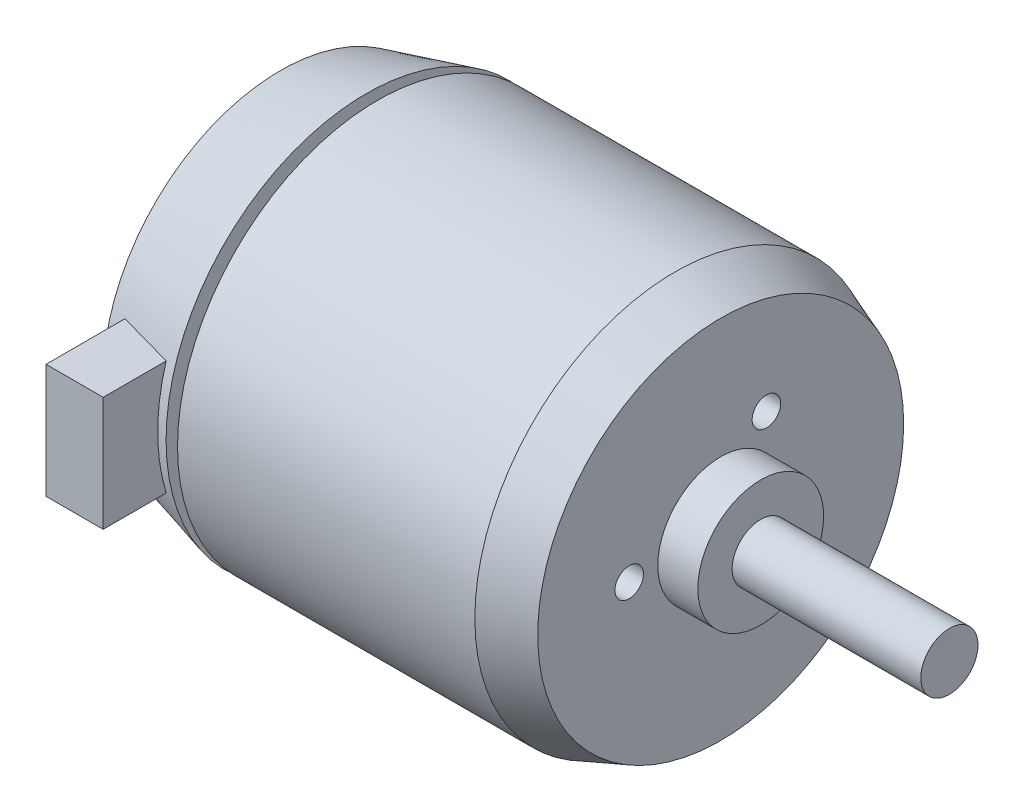
from build123d import *

# Parameters (mm, degrees)
BOSS_EXTRUDE1_REACH            = 59.868
SKETCH2_W                      = 5
SKETCH2_H                      = 10
SKETCH3_R                      = 4
BOSS_EXTRUDE2_DEPTH            = 1
SKETCH4_R                      = 5.5
BOSS_EXTRUDE3_DEPTH            = 3.5
SKETCH5_R                      = 2.5
BOSS_EXTRUDE4_DEPTH            = 16.5
F_2_5_2_5_DIAMETER_HOLE1_D     = 2.5
F_2_5_2_5_DIAMETER_HOLE1_DEPTH = 28
F_2_5_2_5_DIAMETER_HOLE1_TIP   = 0.751075774
F_3_0_3_DIAMETER_HOLE1_D       = 3
F_3_0_3_DIAMETER_HOLE1_DEPTH   = 28
F_3_0_3_DIAMETER_HOLE1_TIP     = 0.901290929
CHAMFER1_SIZE                  = 1.5
CHAMFER1_SIZE2                 = 4


with BuildPart() as part:
    # Sketch1 → Revolve1 (revolve)
    with BuildSketch(Plane.XY, mode=Mode.PRIVATE) as revolve1_sk:
        Polygon((0, 15.5), (0, 0), (38.5, 0), (38.5, 17.5), (8.5, 17.5), (8.5, 12.5), (7.5, 12.5), (7.5, 17.5), align=None)
    revolve(revolve1_sk.sketch.rotate(Axis((0, 0, 0), (1, 0, 0)), 270), axis=Axis((0, 0, 0), (1, 0, 0)))

    # Sketch2 → Boss-Extrude1 (add, up to next)
    with BuildSketch(Plane.XY.offset(22), mode=Mode.PRIVATE) as boss_extrude1_sk1:
        with Locations((4, 0)):
            Rectangle(SKETCH2_W, SKETCH2_H)
    boss_extrude1_tool1 = extrude(boss_extrude1_sk1.sketch, amount=-BOSS_EXTRUDE1_REACH, mode=Mode.PRIVATE) - part.part
    add(boss_extrude1_tool1.solids().sort_by_distance((4, 0, 22))[0])

    # Sketch3 → Boss-Extrude2 (add)
    with BuildSketch(Plane.ZY):
        Circle(SKETCH3_R)
    extrude(amount=BOSS_EXTRUDE2_DEPTH)

    # Sketch4 → Boss-Extrude3 (add)
    with BuildSketch(Plane(origin=(38.5, 0, 0), x_dir=(0, 0, -1), z_dir=(1, 0, 0))):
        with Locations(Location((0, 0, 0), (0, 0, 180))):
            Circle(SKETCH4_R)
    extrude(amount=BOSS_EXTRUDE3_DEPTH)

    # Sketch5 → Boss-Extrude4 (add)
    with BuildSketch(Plane(origin=(42, 0, 0), x_dir=(0, 0, -1), z_dir=(1, 0, 0))):
        Circle(SKETCH5_R)
    extrude(amount=BOSS_EXTRUDE4_DEPTH)

    # Ø2.5 (2.5) Diameter Hole1
    with Locations(Plane(origin=(38.5, 0, 0), x_dir=(0, 0, -1), z_dir=(1, 0, 0))):
        with Locations((4, -6.92820323), (4, 6.92820323), (-8, 0)):
            Hole(F_2_5_2_5_DIAMETER_HOLE1_D / 2, depth=F_2_5_2_5_DIAMETER_HOLE1_DEPTH)
            with Locations((0, 0, -(F_2_5_2_5_DIAMETER_HOLE1_DEPTH + F_2_5_2_5_DIAMETER_HOLE1_TIP / 2))):  # 118° drill point
                Cone(0, F_2_5_2_5_DIAMETER_HOLE1_D / 2, F_2_5_2_5_DIAMETER_HOLE1_TIP, mode=Mode.SUBTRACT)

    # Ø3.0 (3) Diameter Hole1
    with Locations(Plane.ZY):
        with Locations((-6.717514421, -6.717514421), (8.838834765, -8.838834765), (6.717514421, 6.717514421), (-8.838834765, 8.838834765)):
            Hole(F_3_0_3_DIAMETER_HOLE1_D / 2, depth=F_3_0_3_DIAMETER_HOLE1_DEPTH)
            with Locations((0, 0, -(F_3_0_3_DIAMETER_HOLE1_DEPTH + F_3_0_3_DIAMETER_HOLE1_TIP / 2))):  # 118° drill point
                Cone(0, F_3_0_3_DIAMETER_HOLE1_D / 2, F_3_0_3_DIAMETER_HOLE1_TIP, mode=Mode.SUBTRACT)

    # Chamfer1
    chamfer1_edges = [part.edges().sort_by_distance(p)[0] for p in [
        (38.5, 0, 17.5),
    ]]
    chamfer1_side = [part.faces().sort_by_distance(p)[0] for p in [
        (38.5, 0, 17.005025253),
    ]]
    chamfer(chamfer1_edges, length=CHAMFER1_SIZE, length2=CHAMFER1_SIZE2, reference=chamfer1_side[0])


solid = part.part
